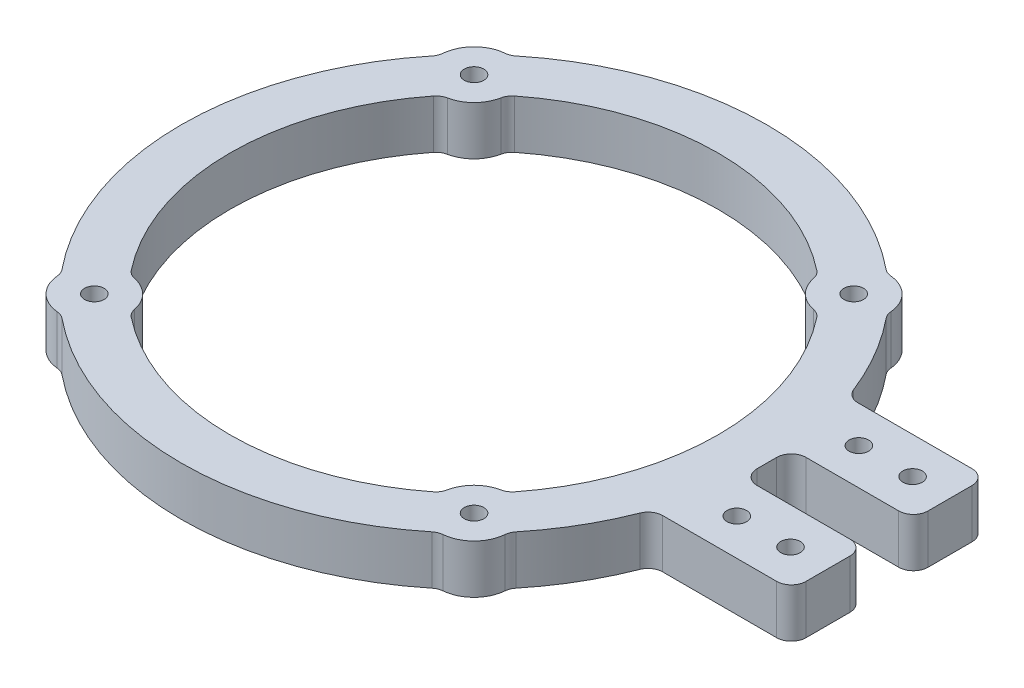
from build123d import *

# Parameters (mm, degrees)
SKETCH1_R           = 50
BOSS_EXTRUDE1_DEPTH = 10
SKETCH3_R           = 7
BOSS_EXTRUDE2_DEPTH = 10
SKETCH4_R           = 2
CUT_EXTRUDE1_DEPTH  = 10
FILLET1_R           = 3
SKETCH5_R           = 2
CUT_EXTRUDE2_DEPTH  = 10


with BuildPart() as part:
    # Sketch1 → Boss-Extrude1 (new body)
    with BuildSketch(Plane(origin=(0, 0, 0), x_dir=(1, 0, 0), z_dir=(0, 1, 0))):
        with BuildLine():
            Line((56.568542495, -20), (85, -20))
            Line((85, -20), (85, -5))
            Line((85, -5), (60, -5))
            Line((60, -5), (60, 5))
            Line((60, 5), (85, 5))
            Line((85, 5), (85, 20))
            Line((85, 20), (56.568542495, 20))
            ThreePointArc((56.568542495, 20), (-60, 0), (56.568542495, -20))
        make_face()
        with Locations(Location((0, 0, 0), (0, 0, 270))):
            Circle(SKETCH1_R, mode=Mode.SUBTRACT)
    extrude(amount=BOSS_EXTRUDE1_DEPTH)

    # Sketch3 → Boss-Extrude2 (add)
    with BuildSketch(Plane(origin=(0, 10, 0), x_dir=(1, 0, 0), z_dir=(0, 1, 0))):
        with Locations((38.890872965, -38.890872965)):
            Circle(SKETCH3_R)
        with Locations((-38.890872965, -38.890872965)):
            Circle(SKETCH3_R)
        with Locations((-38.890872965, 38.890872965)):
            Circle(SKETCH3_R)
        with Locations((38.890872965, 38.890872965)):
            Circle(SKETCH3_R)
    extrude(amount=-BOSS_EXTRUDE2_DEPTH)

    # Sketch4 → Cut-Extrude1 (cut)
    with BuildSketch(Plane(origin=(0, 10, 0), x_dir=(1, 0, 0), z_dir=(0, 1, 0))):
        with Locations(Location((38.890872965, -38.890872965, 0), (0, 0, 270))):
            Circle(SKETCH4_R)
        with Locations(Location((-38.890872965, -38.890872965, 0), (0, 0, 270))):
            Circle(SKETCH4_R)
        with Locations(Location((-38.890872965, 38.890872965, 0), (0, 0, 270))):
            Circle(SKETCH4_R)
        with Locations(Location((38.890872965, 38.890872965, 0), (0, 0, 270))):
            Circle(SKETCH4_R)
    extrude(amount=-CUT_EXTRUDE1_DEPTH, mode=Mode.SUBTRACT)

    # Fillet1
    fillet1_edges = [part.edges().sort_by_distance(p)[0] for p in [
        (85, 5, 20),
        (56.568542495, 5, 20),
        (56.568542495, 5, -20),
        (85, 5, -20),
        (85, 5, -5),
        (60, 5, -5),
        (60, 5, 5),
        (85, 5, 5),
        (38.50034739, 5, 31.901775042),
        (31.901775042, 5, 38.50034739),
        (38.657283604, 5, 45.886974452),
        (45.886974452, 5, 38.657283604),
        (-31.901775042, 5, 38.50034739),
        (-38.50034739, 5, 31.901775042),
        (-45.886974452, 5, 38.657283604),
        (-38.657283604, 5, 45.886974452),
        (-38.657283604, 5, -45.886974452),
        (-45.886974452, 5, -38.657283604),
        (-31.901775042, 5, -38.50034739),
        (-38.50034739, 5, -31.901775042),
        (45.886974452, 5, -38.657283604),
        (38.657283604, 5, -45.886974452),
        (38.50034739, 5, -31.901775042),
        (31.901775042, 5, -38.50034739),
    ]]
    fillet(fillet1_edges, radius=FILLET1_R)

    # Sketch5 → Cut-Extrude2 (cut)
    with BuildSketch(Plane(origin=(0, 10, 0), x_dir=(1, 0, 0), z_dir=(0, 1, 0))):
        with Locations(Location((66.325756597, 12.5, 0), (0, 0, 270))):
            Circle(SKETCH5_R)
        with Locations(Location((77.325756597, 12.5, 0), (0, 0, 270))):
            Circle(SKETCH5_R)
        with Locations(Location((66.325756597, -12.5, 0), (0, 0, 270))):
            Circle(SKETCH5_R)
        with Locations(Location((77.325756597, -12.5, 0), (0, 0, 270))):
            Circle(SKETCH5_R)
    extrude(amount=-CUT_EXTRUDE2_DEPTH, mode=Mode.SUBTRACT)


solid = part.part
